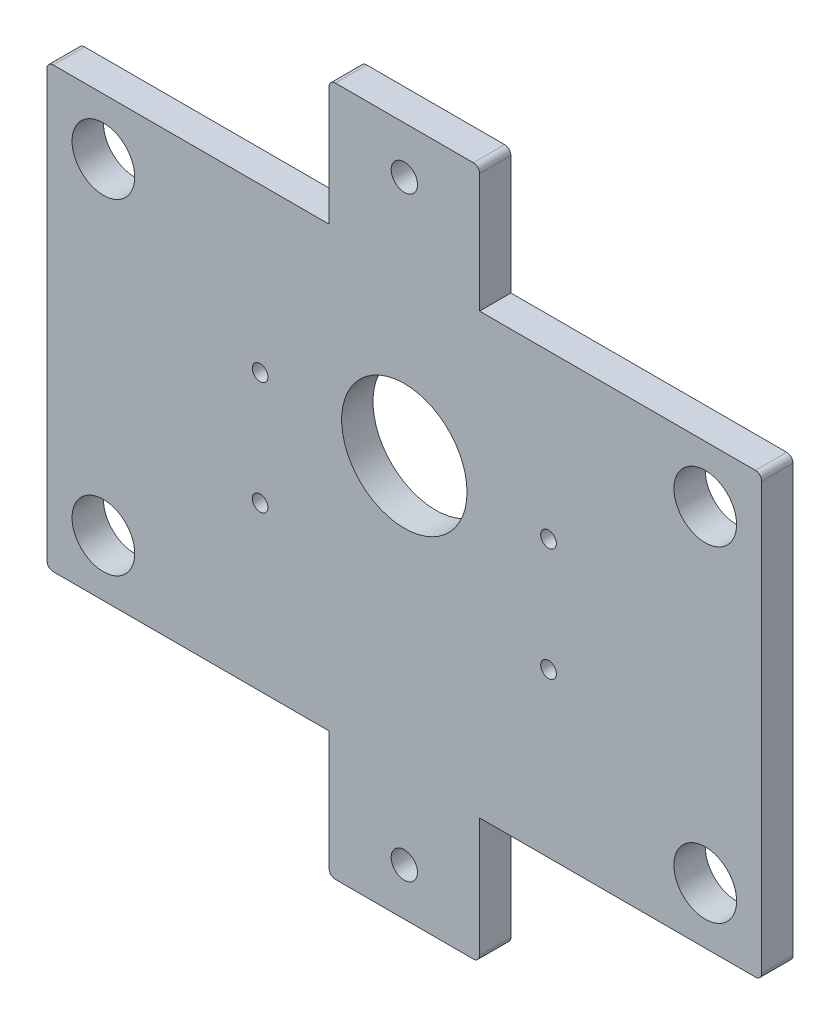
from build123d import *

# Parameters (mm, degrees)
EXTRUDE_1_DEPTH     = 5
FILLET_2_R          = 1
HOLE_WIZARD_M3_1_D  = 2.5
SKETCH_5_R          = 5
CUT_EXTRUDE_1_DEPTH = 5
HOLE_WIZARD_M5_1_D  = 4.2
SKETCH_7_R          = 10
CUT_EXTRUDE_2_DEPTH = 80.366239674


with BuildPart() as part:
    # 草图1 → 凸台-拉伸1 (new body)
    with BuildSketch(Plane.XY):
        Polygon((-57, 35), (-57, -35), (-12, -35), (-12, -55), (12, -55), (12, -35), (57, -35), (57, 35), (12, 35), (12, 55), (-12, 55), (-12, 35), align=None)
    extrude(amount=EXTRUDE_1_DEPTH)

    # 圆角2
    fillet_2_edges = [part.edges().sort_by_distance(p)[0] for p in [
        (-12, 55, 2.5),
        (12, 55, 2.5),
        (57, 35, 2.5),
        (57, -35, 2.5),
        (12, -55, 2.5),
        (-12, -55, 2.5),
        (-57, -35, 2.5),
        (-57, 35, 2.5),
    ]]
    fillet(fillet_2_edges, radius=FILLET_2_R)

    # M3 螺纹孔的螺纹孔钻头1 (through all)
    with Locations(Plane(origin=(-23, 9, 5), x_dir=(1, 0, 0), z_dir=(0, 0, 1))):
        with Locations((0, 0), (0, -18)):
            hole_wizard_m3_1 = Hole(HOLE_WIZARD_M3_1_D / 2)

    # 镜向1: M3 螺纹孔的螺纹孔钻头1 across plane
    add(hole_wizard_m3_1.mirror(Plane(origin=(0, 0, 0), x_dir=(0, 0, 1), z_dir=(1, 0, 0))), mode=Mode.SUBTRACT)

    # 草图5 → 切除-拉伸1 (cut)
    with BuildSketch(Plane.XY.offset(5)):
        with Locations((-48, 26)):
            Circle(SKETCH_5_R)
        with Locations((-48, -26)):
            Circle(SKETCH_5_R)
    cut_extrude_1 = extrude(amount=-CUT_EXTRUDE_1_DEPTH, mode=Mode.SUBTRACT)

    # 镜向2: 切除-拉伸1 across plane
    add(cut_extrude_1.mirror(Plane(origin=(0, 0, 0), x_dir=(0, 0, 1), z_dir=(1, 0, 0))), mode=Mode.SUBTRACT)

    # M5 螺纹孔的螺纹孔钻头1 (through all)
    with Locations(Plane(origin=(0, 47.5, 5), x_dir=(1, 0, 0), z_dir=(0, 0, 1))):
        with Locations((0, 0)):
            hole_wizard_m5_1 = Hole(HOLE_WIZARD_M5_1_D / 2)

    # 镜向3: M5 螺纹孔的螺纹孔钻头1 across plane
    add(hole_wizard_m5_1.mirror(Plane.ZX), mode=Mode.SUBTRACT)

    # 草图7 → 切除-拉伸2 (cut, through all)
    with BuildSketch(Plane.XY.offset(5)):
        with Locations((0, 9)):
            Circle(SKETCH_7_R)
    extrude(amount=-CUT_EXTRUDE_2_DEPTH, mode=Mode.SUBTRACT)


solid = part.part
